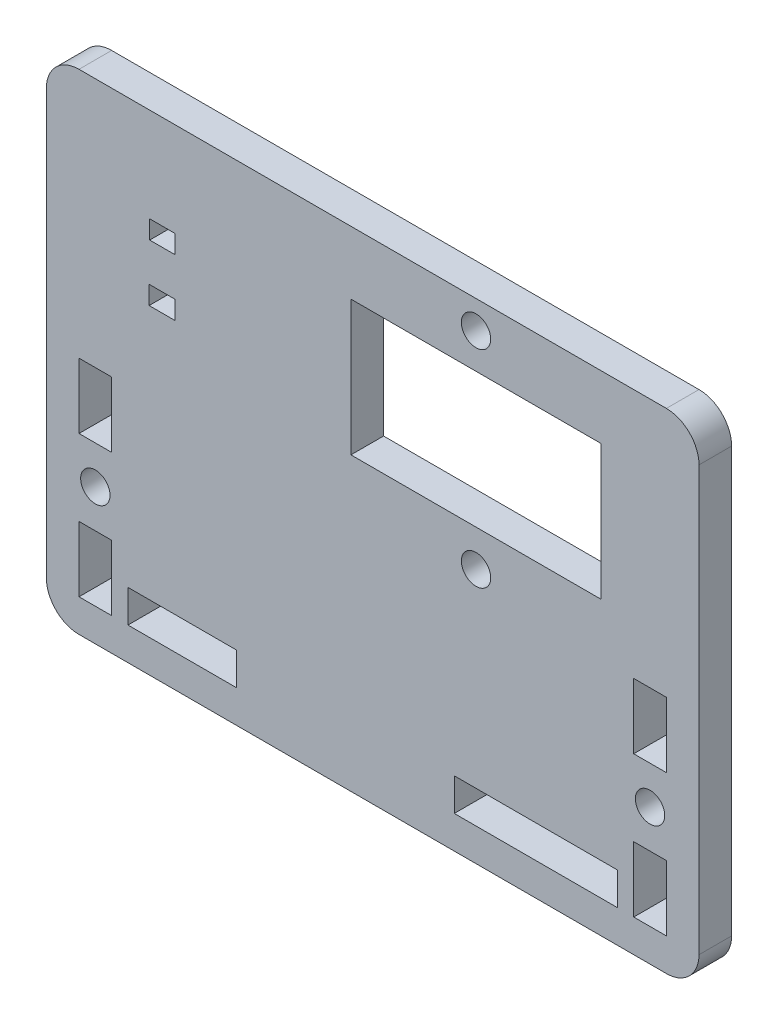
from build123d import *

# Parameters (mm, degrees)
SKETCH_1_R      = 1.35
SKETCH_1_W      = 3
SKETCH_1_H      = 6
SKETCH_1_W_2    = 15
SKETCH_1_H_2    = 3
SKETCH_1_W_3    = 22.999
SKETCH_1_H_3    = 12.401
SKETCH_1_W_4    = 2.327
SKETCH_1_H_4    = 1.693
SKETCH_1_W_5    = 2.381
SKETCH_1_H_5    = 1.694
SKETCH_1_W_6    = 10
EXTRUDE_1_DEPTH = 3


with BuildPart() as part:
    # 草图1 → 凸台-拉伸1 (new body)
    with BuildSketch(Plane(origin=(0, 0, 0), x_dir=(-1, 0, 0), z_dir=(0, 0, -1))):
        with BuildLine():
            Line((-28.066816536, 0), (25.933183464, 0))
            ThreePointArc((25.933183464, 0), (28.054503808, 0.878679656), (28.933183464, 3))
            Line((28.933183464, 3), (28.933183464, 41.999))
            ThreePointArc((28.933183464, 41.999), (28.054503808, 44.120320344), (25.933183464, 44.999))
            Line((25.933183464, 44.999), (-28.066816536, 44.999))
            ThreePointArc((-28.066816536, 44.999), (-30.18813688, 44.120320344), (-31.066816536, 41.999))
            Line((-31.066816536, 41.999), (-31.066816536, 3))
            ThreePointArc((-31.066816536, 3), (-30.18813688, 0.878679656), (-28.066816536, 0))
        make_face()
        with Locations(Location((-10.567816536, 42.429, 0), (0, 0, 180))):
            Circle(SKETCH_1_R, mode=Mode.SUBTRACT)
        with Locations(Location((24.432183464, 12.499, 0), (0, 0, 180))):
            Circle(SKETCH_1_R, mode=Mode.SUBTRACT)
        with Locations(Location((-10.567816536, 23.43, 0), (0, 0, 180))):
            Circle(SKETCH_1_R, mode=Mode.SUBTRACT)
        with Locations(Location((-26.567767322, 12.499, 0), (0, 0, 180))):
            Circle(SKETCH_1_R, mode=Mode.SUBTRACT)
        with Locations((-26.566816536, 18.999)):
            Rectangle(SKETCH_1_W, SKETCH_1_H, mode=Mode.SUBTRACT)
        with Locations((-26.566816536, 5.999)):
            Rectangle(SKETCH_1_W, SKETCH_1_H, mode=Mode.SUBTRACT)
        with Locations((-16.067816536, 4.499)):
            Rectangle(SKETCH_1_W_2, SKETCH_1_H_2, mode=Mode.SUBTRACT)
        with Locations((-10.567316536, 32.9995)):
            Rectangle(SKETCH_1_W_3, SKETCH_1_H_3, mode=Mode.SUBTRACT)
        with Locations((18.271683464, 35.4965)):
            Rectangle(SKETCH_1_W_4, SKETCH_1_H_4, mode=Mode.SUBTRACT)
        with Locations((18.298683464, 30.257)):
            Rectangle(SKETCH_1_W_5, SKETCH_1_H_5, mode=Mode.SUBTRACT)
        with Locations((24.433183464, 18.999)):
            Rectangle(SKETCH_1_W, SKETCH_1_H, mode=Mode.SUBTRACT)
        with Locations((24.433183464, 5.999)):
            Rectangle(SKETCH_1_W, SKETCH_1_H, mode=Mode.SUBTRACT)
        with Locations((16.432183464, 4.499)):
            Rectangle(SKETCH_1_W_6, SKETCH_1_H_2, mode=Mode.SUBTRACT)
    extrude(amount=-EXTRUDE_1_DEPTH)


solid = part.part
